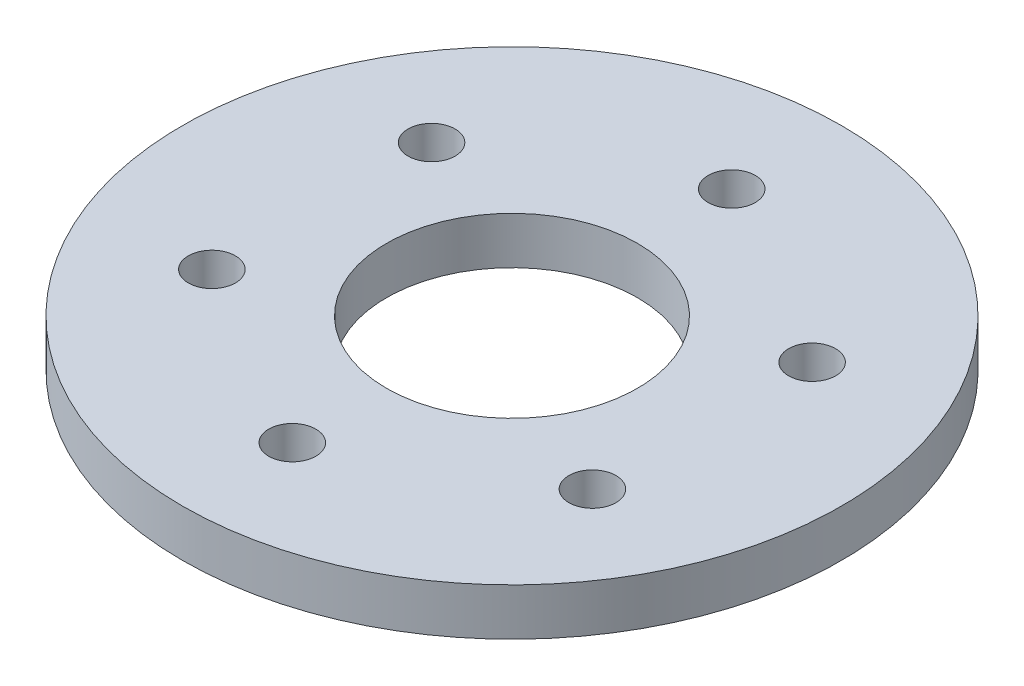
from build123d import *

# Parameters (mm, degrees)
SKETCH_1_R      = 21
SKETCH_1_R_2    = 1.5
SKETCH_1_R_3    = 8
EXTRUDE_1_DEPTH = 3


with BuildPart() as part:
    # 草图1 → 凸台-拉伸1 (new body)
    with BuildSketch(Plane(origin=(0, 0, 0), x_dir=(1, 0, 0), z_dir=(0, 1, 0))):
        Circle(SKETCH_1_R)
        with Locations((0, 14)):
            Circle(SKETCH_1_R_2, mode=Mode.SUBTRACT)
        with Locations((12.124355653, 7)):
            Circle(SKETCH_1_R_2, mode=Mode.SUBTRACT)
        with Locations((12.124355653, -7)):
            Circle(SKETCH_1_R_2, mode=Mode.SUBTRACT)
        with Locations((0, -14)):
            Circle(SKETCH_1_R_2, mode=Mode.SUBTRACT)
        with Locations((-12.124355653, -7)):
            Circle(SKETCH_1_R_2, mode=Mode.SUBTRACT)
        with Locations((-12.124355653, 7)):
            Circle(SKETCH_1_R_2, mode=Mode.SUBTRACT)
        Circle(SKETCH_1_R_3, mode=Mode.SUBTRACT)
    extrude(amount=EXTRUDE_1_DEPTH)


solid = part.part
